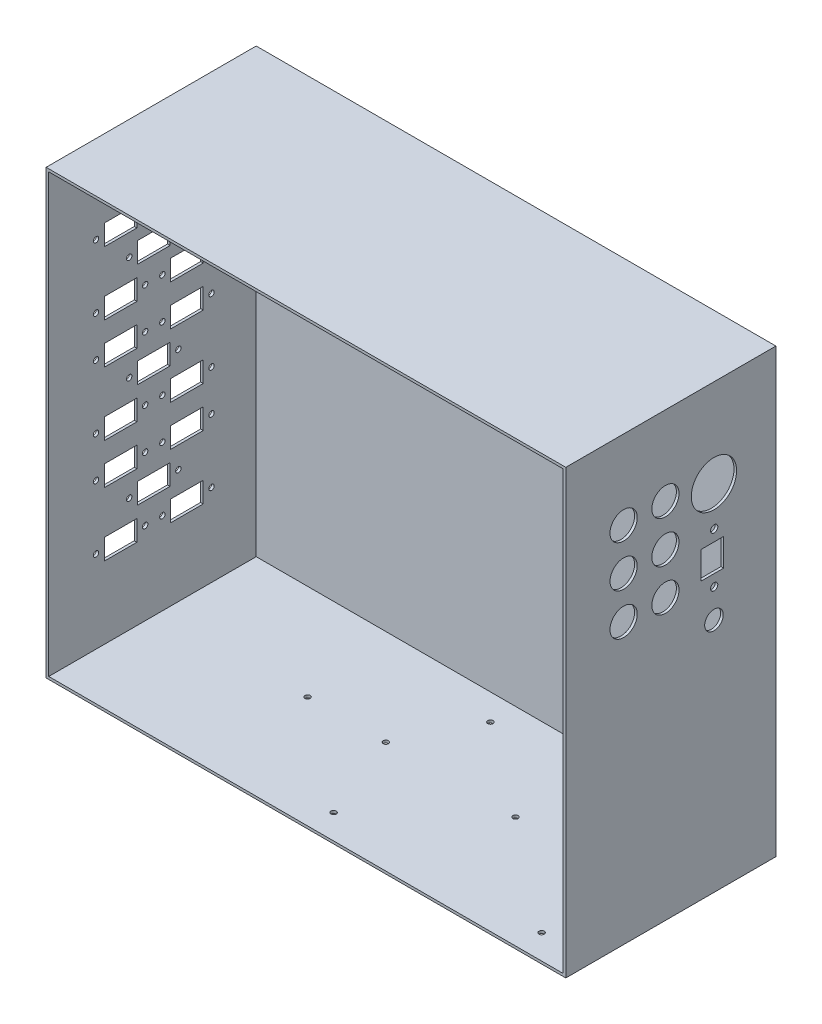
from build123d import *

# Parameters (mm, degrees)
SKETCH2_W                        = 298.45
SKETCH2_H                        = 254
BOSS_EXTRUDE1_DEPTH              = 120.65
SHELL1_T                         = -1.5
PT_CONNECTOR_CUTOUTS_REACH       = 348.06
SKETCH3_R                        = 7.8105
SKETCH3_R_2                      = 2.06375
SKETCH3_R_3                      = 5.334
SKETCH3_R_4                      = 13.0175
SKETCH3_W                        = 13.081
SKETCH3_H                        = 15.748
SKETCH4_R                        = 1.55
SKETCH4_W                        = 18.7
SKETCH4_H                        = 11.8
SOLENOID_CONNECTOR_CUTOUTS_DEPTH = 1.5
SKETCH5_R                        = 1.524
PCB_MOUNTING_HOLES_DEPTH         = 1.5


with BuildPart() as part:
    # Sketch2 → Boss-Extrude1 (new body)
    with BuildSketch(Plane.XY):
        Rectangle(SKETCH2_W, SKETCH2_H)
    extrude(amount=BOSS_EXTRUDE1_DEPTH)

    # Shell1
    shell1_openings = [part.faces().sort_by_distance(p)[0] for p in [
        (0, 0, 120.65),
    ]]
    offset(amount=SHELL1_T, openings=shell1_openings, kind=Kind.INTERSECTION)

    # Sketch3 → PT Connector Cutouts (cut, up to next)
    with BuildSketch(Plane(origin=(149.225, 0, 0), x_dir=(0, 0, -1), z_dir=(1, 0, 0)), mode=Mode.PRIVATE) as pt_connector_cutouts_sk1:
        with Locations((-87.4395, 33.555885142)):
            Circle(SKETCH3_R)
    pt_connector_cutouts_tool1 = extrude(pt_connector_cutouts_sk1.sketch, amount=-PT_CONNECTOR_CUTOUTS_REACH, mode=Mode.PRIVATE) & part.part
    # Sketch3 → PT Connector Cutouts (cut, up to next)
    with BuildSketch(Plane(origin=(149.225, 0, 0), x_dir=(0, 0, -1), z_dir=(1, 0, 0)), mode=Mode.PRIVATE) as pt_connector_cutouts_sk2:
        with Locations((-63.4395, 33.555885142)):
            Circle(SKETCH3_R)
    pt_connector_cutouts_tool2 = extrude(pt_connector_cutouts_sk2.sketch, amount=-PT_CONNECTOR_CUTOUTS_REACH, mode=Mode.PRIVATE) & part.part
    # Sketch3 → PT Connector Cutouts (cut, up to next)
    with BuildSketch(Plane(origin=(149.225, 0, 0), x_dir=(0, 0, -1), z_dir=(1, 0, 0)), mode=Mode.PRIVATE) as pt_connector_cutouts_sk3:
        with Locations((-63.4395, 57.555885142)):
            Circle(SKETCH3_R)
    pt_connector_cutouts_tool3 = extrude(pt_connector_cutouts_sk3.sketch, amount=-PT_CONNECTOR_CUTOUTS_REACH, mode=Mode.PRIVATE) & part.part
    # Sketch3 → PT Connector Cutouts (cut, up to next)
    with BuildSketch(Plane(origin=(149.225, 0, 0), x_dir=(0, 0, -1), z_dir=(1, 0, 0)), mode=Mode.PRIVATE) as pt_connector_cutouts_sk4:
        with Locations((-63.4395, 81.555885142)):
            Circle(SKETCH3_R)
    pt_connector_cutouts_tool4 = extrude(pt_connector_cutouts_sk4.sketch, amount=-PT_CONNECTOR_CUTOUTS_REACH, mode=Mode.PRIVATE) & part.part
    # Sketch3 → PT Connector Cutouts (cut, up to next)
    with BuildSketch(Plane(origin=(149.225, 0, 0), x_dir=(0, 0, -1), z_dir=(1, 0, 0)), mode=Mode.PRIVATE) as pt_connector_cutouts_sk5:
        with Locations((-87.4395, 57.555885142)):
            Circle(SKETCH3_R)
    pt_connector_cutouts_tool5 = extrude(pt_connector_cutouts_sk5.sketch, amount=-PT_CONNECTOR_CUTOUTS_REACH, mode=Mode.PRIVATE) & part.part
    # Sketch3 → PT Connector Cutouts (cut, up to next)
    with BuildSketch(Plane(origin=(149.225, 0, 0), x_dir=(0, 0, -1), z_dir=(1, 0, 0)), mode=Mode.PRIVATE) as pt_connector_cutouts_sk6:
        with Locations((-87.4395, 81.555885142)):
            Circle(SKETCH3_R)
    pt_connector_cutouts_tool6 = extrude(pt_connector_cutouts_sk6.sketch, amount=-PT_CONNECTOR_CUTOUTS_REACH, mode=Mode.PRIVATE) & part.part
    # Sketch3 → PT Connector Cutouts (cut, up to next)
    with BuildSketch(Plane(origin=(149.225, 0, 0), x_dir=(0, 0, -1), z_dir=(1, 0, 0)), mode=Mode.PRIVATE) as pt_connector_cutouts_sk7:
        with Locations((-35.418702679, 25.011064362)):
            Circle(SKETCH3_R_2)
    pt_connector_cutouts_tool7 = extrude(pt_connector_cutouts_sk7.sketch, amount=-PT_CONNECTOR_CUTOUTS_REACH, mode=Mode.PRIVATE) & part.part
    # Sketch3 → PT Connector Cutouts (cut, up to next)
    with BuildSketch(Plane(origin=(149.225, 0, 0), x_dir=(0, 0, -1), z_dir=(1, 0, 0)), mode=Mode.PRIVATE) as pt_connector_cutouts_sk8:
        with Locations(Location((-35.418702679, 53.840064362, 0), (0, 0, 180))):
            Circle(SKETCH3_R_2)
    pt_connector_cutouts_tool8 = extrude(pt_connector_cutouts_sk8.sketch, amount=-PT_CONNECTOR_CUTOUTS_REACH, mode=Mode.PRIVATE) & part.part
    # Sketch3 → PT Connector Cutouts (cut, up to next)
    with BuildSketch(Plane(origin=(149.225, 0, 0), x_dir=(0, 0, -1), z_dir=(1, 0, 0)), mode=Mode.PRIVATE) as pt_connector_cutouts_sk9:
        with Locations((-35.56, 8.501064362)):
            Circle(SKETCH3_R_3)
    pt_connector_cutouts_tool9 = extrude(pt_connector_cutouts_sk9.sketch, amount=-PT_CONNECTOR_CUTOUTS_REACH, mode=Mode.PRIVATE) & part.part
    # Sketch3 → PT Connector Cutouts (cut, up to next)
    with BuildSketch(Plane(origin=(149.225, 0, 0), x_dir=(0, 0, -1), z_dir=(1, 0, 0)), mode=Mode.PRIVATE) as pt_connector_cutouts_sk10:
        with Locations((-35.56, 76.348885142)):
            Circle(SKETCH3_R_4)
    pt_connector_cutouts_tool10 = extrude(pt_connector_cutouts_sk10.sketch, amount=-PT_CONNECTOR_CUTOUTS_REACH, mode=Mode.PRIVATE) & part.part
    # Sketch3 → PT Connector Cutouts (cut, up to next)
    with BuildSketch(Plane(origin=(149.225, 0, 0), x_dir=(0, 0, -1), z_dir=(1, 0, 0)), mode=Mode.PRIVATE) as pt_connector_cutouts_sk11:
        with Locations((-36.546800253, 39.425564362)):
            Rectangle(SKETCH3_W, SKETCH3_H)
    pt_connector_cutouts_tool11 = extrude(pt_connector_cutouts_sk11.sketch, amount=-PT_CONNECTOR_CUTOUTS_REACH, mode=Mode.PRIVATE) & part.part
    add(pt_connector_cutouts_tool1.solids().sort_by_distance((149.225, 33.555885, 87.4395))[0], mode=Mode.SUBTRACT)
    add(pt_connector_cutouts_tool2.solids().sort_by_distance((149.225, 33.555885, 63.4395))[0], mode=Mode.SUBTRACT)
    add(pt_connector_cutouts_tool3.solids().sort_by_distance((149.225, 57.555885, 63.4395))[0], mode=Mode.SUBTRACT)
    add(pt_connector_cutouts_tool4.solids().sort_by_distance((149.225, 81.555885, 63.4395))[0], mode=Mode.SUBTRACT)
    add(pt_connector_cutouts_tool5.solids().sort_by_distance((149.225, 57.555885, 87.4395))[0], mode=Mode.SUBTRACT)
    add(pt_connector_cutouts_tool6.solids().sort_by_distance((149.225, 81.555885, 87.4395))[0], mode=Mode.SUBTRACT)
    add(pt_connector_cutouts_tool7.solids().sort_by_distance((149.225, 25.011064, 35.418703))[0], mode=Mode.SUBTRACT)
    add(pt_connector_cutouts_tool8.solids().sort_by_distance((149.225, 53.840064, 35.418703))[0], mode=Mode.SUBTRACT)
    add(pt_connector_cutouts_tool9.solids().sort_by_distance((149.225, 8.501064, 35.56))[0], mode=Mode.SUBTRACT)
    add(pt_connector_cutouts_tool10.solids().sort_by_distance((149.225, 76.348885, 35.56))[0], mode=Mode.SUBTRACT)
    add(pt_connector_cutouts_tool11.solids().sort_by_distance((149.225, 39.425564, 36.5468))[0], mode=Mode.SUBTRACT)

    # Sketch4 → Solenoid Connector Cutouts (cut)
    with BuildSketch(Plane.ZY.offset(149.225)):
        with Locations(Location((55.387501773, 78.156254231, 0), (0, 0, 270))):
            Circle(SKETCH4_R)
        with Locations(Location((27.162501773, 78.156254231, 0), (0, 0, 90))):
            Circle(SKETCH4_R)
        with Locations(Location((93.487501773, 78.156254231, 0), (0, 0, 270))):
            Circle(SKETCH4_R)
        with Locations(Location((65.262501773, 78.156254231, 0), (0, 0, 90))):
            Circle(SKETCH4_R)
        with Locations(Location((93.487501773, 41.643754231, 0), (0, 0, 270))):
            Circle(SKETCH4_R)
        with Locations(Location((65.262501773, 41.643754231, 0), (0, 0, 90))):
            Circle(SKETCH4_R)
        with Locations(Location((93.487501773, 18.256254231, 0), (0, 0, 270))):
            Circle(SKETCH4_R)
        with Locations(Location((65.262501773, 18.256254231, 0), (0, 0, 90))):
            Circle(SKETCH4_R)
        with Locations(Location((93.487501773, -18.256245769, 0), (0, 0, 270))):
            Circle(SKETCH4_R)
        with Locations(Location((65.262501773, -18.256245769, 0), (0, 0, 90))):
            Circle(SKETCH4_R)
        with Locations(Location((93.487501773, -41.643745769, 0), (0, 0, 270))):
            Circle(SKETCH4_R)
        with Locations(Location((65.262501773, -41.643745769, 0), (0, 0, 90))):
            Circle(SKETCH4_R)
        with Locations(Location((93.487501773, -78.156245769, 0), (0, 0, 270))):
            Circle(SKETCH4_R)
        with Locations(Location((65.262501773, -78.156245769, 0), (0, 0, 90))):
            Circle(SKETCH4_R)
        with Locations(Location((74.437501773, 59.900004231, 0), (0, 0, 270))):
            Circle(SKETCH4_R)
        with Locations(Location((46.212501773, 59.900004231, 0), (0, 0, 90))):
            Circle(SKETCH4_R)
        with Locations(Location((55.387501773, 41.643754231, 0), (0, 0, 270))):
            Circle(SKETCH4_R)
        with Locations(Location((27.162501773, 41.643754231, 0), (0, 0, 90))):
            Circle(SKETCH4_R)
        with Locations(Location((55.387501773, 18.256254231, 0), (0, 0, 270))):
            Circle(SKETCH4_R)
        with Locations(Location((27.162501773, 18.256254231, 0), (0, 0, 90))):
            Circle(SKETCH4_R)
        with Locations(Location((74.437501773, 4.231e-06, 0), (0, 0, 270))):
            Circle(SKETCH4_R)
        with Locations(Location((46.212501773, 4.231e-06, 0), (0, 0, 90))):
            Circle(SKETCH4_R)
        with Locations(Location((55.387501773, -18.256245769, 0), (0, 0, 270))):
            Circle(SKETCH4_R)
        with Locations(Location((27.162501773, -18.256245769, 0), (0, 0, 90))):
            Circle(SKETCH4_R)
        with Locations(Location((55.387501773, -41.643745769, 0), (0, 0, 270))):
            Circle(SKETCH4_R)
        with Locations(Location((27.162501773, -41.643745769, 0), (0, 0, 90))):
            Circle(SKETCH4_R)
        with Locations(Location((74.437501773, -59.899995769, 0), (0, 0, 270))):
            Circle(SKETCH4_R)
        with Locations(Location((46.212501773, -59.899995769, 0), (0, 0, 90))):
            Circle(SKETCH4_R)
        with Locations(Location((55.387501773, -78.156245769, 0), (0, 0, 270))):
            Circle(SKETCH4_R)
        with Locations(Location((27.162501773, -78.156245769, 0), (0, 0, 90))):
            Circle(SKETCH4_R)
        with Locations((41.275001773, 78.156254231)):
            Rectangle(SKETCH4_W, SKETCH4_H)
        with Locations((79.375001773, 78.156254231)):
            Rectangle(SKETCH4_W, SKETCH4_H)
        with Locations((79.375001773, 41.643754231)):
            Rectangle(SKETCH4_W, SKETCH4_H)
        with Locations((79.375001773, 18.256254231)):
            Rectangle(SKETCH4_W, SKETCH4_H)
        with Locations((79.375001773, -18.256245769)):
            Rectangle(SKETCH4_W, SKETCH4_H)
        with Locations((79.375001773, -41.643745769)):
            Rectangle(SKETCH4_W, SKETCH4_H)
        with Locations((79.375001773, -78.156245769)):
            Rectangle(SKETCH4_W, SKETCH4_H)
        with Locations((60.325001773, 59.900004231)):
            Rectangle(SKETCH4_W, SKETCH4_H)
        with Locations((41.275001773, 41.643754231)):
            Rectangle(SKETCH4_W, SKETCH4_H)
        with Locations((41.275001773, 18.256254231)):
            Rectangle(SKETCH4_W, SKETCH4_H)
        with Locations((60.325001773, 4.231e-06)):
            Rectangle(SKETCH4_W, SKETCH4_H)
        with Locations((41.275001773, -18.256245769)):
            Rectangle(SKETCH4_W, SKETCH4_H)
        with Locations((41.275001773, -41.643745769)):
            Rectangle(SKETCH4_W, SKETCH4_H)
        with Locations((60.325001773, -59.899995769)):
            Rectangle(SKETCH4_W, SKETCH4_H)
        with Locations((41.275001773, -78.156245769)):
            Rectangle(SKETCH4_W, SKETCH4_H)
    extrude(amount=-SOLENOID_CONNECTOR_CUTOUTS_DEPTH, mode=Mode.SUBTRACT)

    # Sketch5 → PCB Mounting Holes (cut)
    with BuildSketch(Plane(origin=(0, -127, 127), x_dir=(-1, 0, 0), z_dir=(0, 1, 0))):
        with Locations(Location((-121.235859114, -20.462314931, 0), (0, 0, 270))):
            Circle(SKETCH5_R)
        with Locations(Location((-56.235859114, -70.462314931, 0), (0, 0, 270))):
            Circle(SKETCH5_R)
        with Locations(Location((-121.235859114, -110.462314931, 0), (0, 0, 270))):
            Circle(SKETCH5_R)
        with Locations(Location((-101.235859114, -70.462314931, 0), (0, 0, 270))):
            Circle(SKETCH5_R)
        with Locations(Location((-1.785859114, -20.462314931, 0), (0, 0, 270))):
            Circle(SKETCH5_R)
        with Locations(Location((63.214140886, -70.462314931, 0), (0, 0, 270))):
            Circle(SKETCH5_R)
        with Locations(Location((-1.785859114, -110.462314931, 0), (0, 0, 270))):
            Circle(SKETCH5_R)
        with Locations(Location((18.214140886, -70.462314931, 0), (0, 0, 270))):
            Circle(SKETCH5_R)
    extrude(amount=PCB_MOUNTING_HOLES_DEPTH, mode=Mode.SUBTRACT)


solid = part.part
